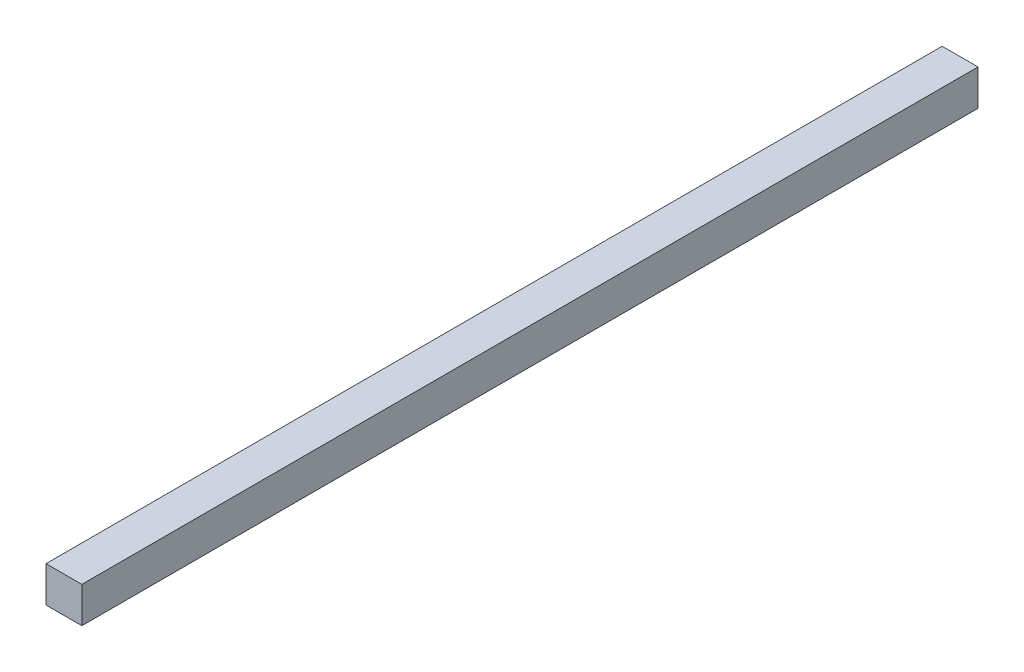
from build123d import *

# Parameters (mm, degrees)
SKETCH1_W           = 3.2
SKETCH1_H           = 3.2
BOSS_EXTRUDE1_DEPTH = 80


with BuildPart() as part:
    # Sketch1 → Boss-Extrude1 (new body)
    with BuildSketch(Plane.XY):
        Rectangle(SKETCH1_W, SKETCH1_H)
    extrude(amount=BOSS_EXTRUDE1_DEPTH)


solid = part.part
